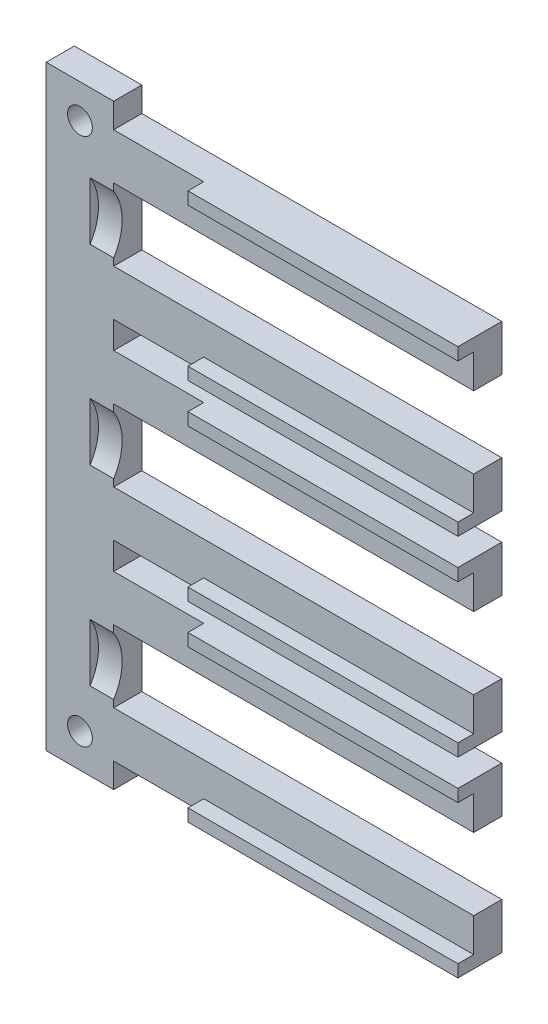
from build123d import *

# Parameters (mm, degrees)
FRONT_GRIP_ACETAL_GUIDE_COMB_SKETCH_W  = 6
FRONT_GRIP_ACETAL_GUIDE_COMB_SKETCH_H  = 53
FRONT_GRIP_ACETAL_GUIDE_COMB_DEPTH     = 2.5
GRIP_GUIDE_LEDGE_1_LOWER_SKETCH_W      = 32.1
GRIP_GUIDE_LEDGE_1_LOWER_SKETCH_H      = 4.1
GRIP_GUIDE_LEDGE_1_LOWER_DEPTH         = 2.5
GRIP_GUIDE_LEDGE_1_UPPER_SKETCH_W      = 32.1
GRIP_GUIDE_LEDGE_1_UPPER_SKETCH_H      = 4.1
GRIP_GUIDE_LEDGE_1_UPPER_DEPTH         = 2.5
GRIP_GUIDE_FENCE_1_LOWER_SKETCH_W      = 24
GRIP_GUIDE_FENCE_1_LOWER_SKETCH_H      = 1.1
GRIP_GUIDE_FENCE_1_LOWER_DEPTH         = 1.5
GRIP_GUIDE_FENCE_1_UPPER_SKETCH_W      = 24
GRIP_GUIDE_FENCE_1_UPPER_SKETCH_H      = 1.1
GRIP_GUIDE_FENCE_1_UPPER_DEPTH         = 1.5
GRIP_GUIDE_LEDGE_2_LOWER_SKETCH_W      = 32.1
GRIP_GUIDE_LEDGE_2_LOWER_SKETCH_H      = 4.1
GRIP_GUIDE_LEDGE_2_LOWER_DEPTH         = 2.5
GRIP_GUIDE_LEDGE_2_UPPER_SKETCH_W      = 32.1
GRIP_GUIDE_LEDGE_2_UPPER_SKETCH_H      = 4.1
GRIP_GUIDE_LEDGE_2_UPPER_DEPTH         = 2.5
GRIP_GUIDE_FENCE_2_LOWER_SKETCH_W      = 24
GRIP_GUIDE_FENCE_2_LOWER_SKETCH_H      = 1.1
GRIP_GUIDE_FENCE_2_LOWER_DEPTH         = 1.5
GRIP_GUIDE_FENCE_2_UPPER_SKETCH_W      = 24
GRIP_GUIDE_FENCE_2_UPPER_SKETCH_H      = 1.1
GRIP_GUIDE_FENCE_2_UPPER_DEPTH         = 1.5
GRIP_GUIDE_LEDGE_3_LOWER_SKETCH_W      = 32.1
GRIP_GUIDE_LEDGE_3_LOWER_SKETCH_H      = 4.1
GRIP_GUIDE_LEDGE_3_LOWER_DEPTH         = 2.5
GRIP_GUIDE_LEDGE_3_UPPER_SKETCH_W      = 32.1
GRIP_GUIDE_LEDGE_3_UPPER_SKETCH_H      = 4.1
GRIP_GUIDE_LEDGE_3_UPPER_DEPTH         = 2.5
GRIP_GUIDE_FENCE_3_LOWER_SKETCH_W      = 24
GRIP_GUIDE_FENCE_3_LOWER_SKETCH_H      = 1.1
GRIP_GUIDE_FENCE_3_LOWER_DEPTH         = 1.5
GRIP_GUIDE_FENCE_3_UPPER_SKETCH_W      = 24
GRIP_GUIDE_FENCE_3_UPPER_SKETCH_H      = 1.1
GRIP_GUIDE_FENCE_3_UPPER_DEPTH         = 1.5
FRONT_GUIDE_SCREW_CLEARANCE_1_SKETCH_R = 1.1
FRONT_GUIDE_SCREW_CLEARANCE_1_DEPTH    = 2.7
FRONT_GUIDE_SCREW_CLEARANCE_2_SKETCH_R = 1.1
FRONT_GUIDE_SCREW_CLEARANCE_2_DEPTH    = 2.7
OUTLET_SEAT_CLEARANCE_1_SKETCH_R       = 4.75
OUTLET_SEAT_CLEARANCE_1_DEPTH          = 2.2
OUTLET_SEAT_CLEARANCE_2_SKETCH_R       = 4.75
OUTLET_SEAT_CLEARANCE_2_DEPTH          = 2.2
OUTLET_SEAT_CLEARANCE_3_SKETCH_R       = 4.75
OUTLET_SEAT_CLEARANCE_3_DEPTH          = 2.2


with BuildPart() as part:
    # Front Grip Acetal Guide Comb sketch → Front Grip Acetal Guide Comb (new body)
    with BuildSketch(Plane.XY.offset(8.5)):
        with Locations((-63.291651246, -29)):
            Rectangle(FRONT_GRIP_ACETAL_GUIDE_COMB_SKETCH_W, FRONT_GRIP_ACETAL_GUIDE_COMB_SKETCH_H)
    extrude(amount=FRONT_GRIP_ACETAL_GUIDE_COMB_DEPTH)

    # Grip Guide Ledge 1 Lower sketch → Grip Guide Ledge 1 Lower (add)
    with BuildSketch(Plane.XY.offset(8.5)):
        with Locations((-44.341651246, -6.75)):
            Rectangle(GRIP_GUIDE_LEDGE_1_LOWER_SKETCH_W, GRIP_GUIDE_LEDGE_1_LOWER_SKETCH_H)
    extrude(amount=GRIP_GUIDE_LEDGE_1_LOWER_DEPTH)

    # Grip Guide Ledge 1 Upper sketch → Grip Guide Ledge 1 Upper (add)
    with BuildSketch(Plane.XY.offset(8.5)):
        with Locations((-44.341651246, -17.25)):
            Rectangle(GRIP_GUIDE_LEDGE_1_UPPER_SKETCH_W, GRIP_GUIDE_LEDGE_1_UPPER_SKETCH_H)
    extrude(amount=GRIP_GUIDE_LEDGE_1_UPPER_DEPTH)

    # Grip Guide Fence 1 Lower sketch → Grip Guide Fence 1 Lower (add)
    with BuildSketch(Plane.XY.offset(10.9)):
        with Locations((-40.291651246, -5.25)):
            Rectangle(GRIP_GUIDE_FENCE_1_LOWER_SKETCH_W, GRIP_GUIDE_FENCE_1_LOWER_SKETCH_H)
    extrude(amount=GRIP_GUIDE_FENCE_1_LOWER_DEPTH)

    # Grip Guide Fence 1 Upper sketch → Grip Guide Fence 1 Upper (add)
    with BuildSketch(Plane.XY.offset(10.9)):
        with Locations((-40.291651246, -18.75)):
            Rectangle(GRIP_GUIDE_FENCE_1_UPPER_SKETCH_W, GRIP_GUIDE_FENCE_1_UPPER_SKETCH_H)
    extrude(amount=GRIP_GUIDE_FENCE_1_UPPER_DEPTH)

    # Grip Guide Ledge 2 Lower sketch → Grip Guide Ledge 2 Lower (add)
    with BuildSketch(Plane.XY.offset(8.5)):
        with Locations((-44.341651246, -23.75)):
            Rectangle(GRIP_GUIDE_LEDGE_2_LOWER_SKETCH_W, GRIP_GUIDE_LEDGE_2_LOWER_SKETCH_H)
    extrude(amount=GRIP_GUIDE_LEDGE_2_LOWER_DEPTH)

    # Grip Guide Ledge 2 Upper sketch → Grip Guide Ledge 2 Upper (add)
    with BuildSketch(Plane.XY.offset(8.5)):
        with Locations((-44.341651246, -34.25)):
            Rectangle(GRIP_GUIDE_LEDGE_2_UPPER_SKETCH_W, GRIP_GUIDE_LEDGE_2_UPPER_SKETCH_H)
    extrude(amount=GRIP_GUIDE_LEDGE_2_UPPER_DEPTH)

    # Grip Guide Fence 2 Lower sketch → Grip Guide Fence 2 Lower (add)
    with BuildSketch(Plane.XY.offset(10.9)):
        with Locations((-40.291651246, -22.25)):
            Rectangle(GRIP_GUIDE_FENCE_2_LOWER_SKETCH_W, GRIP_GUIDE_FENCE_2_LOWER_SKETCH_H)
    extrude(amount=GRIP_GUIDE_FENCE_2_LOWER_DEPTH)

    # Grip Guide Fence 2 Upper sketch → Grip Guide Fence 2 Upper (add)
    with BuildSketch(Plane.XY.offset(10.9)):
        with Locations((-40.291651246, -35.75)):
            Rectangle(GRIP_GUIDE_FENCE_2_UPPER_SKETCH_W, GRIP_GUIDE_FENCE_2_UPPER_SKETCH_H)
    extrude(amount=GRIP_GUIDE_FENCE_2_UPPER_DEPTH)

    # Grip Guide Ledge 3 Lower sketch → Grip Guide Ledge 3 Lower (add)
    with BuildSketch(Plane.XY.offset(8.5)):
        with Locations((-44.341651246, -40.75)):
            Rectangle(GRIP_GUIDE_LEDGE_3_LOWER_SKETCH_W, GRIP_GUIDE_LEDGE_3_LOWER_SKETCH_H)
    extrude(amount=GRIP_GUIDE_LEDGE_3_LOWER_DEPTH)

    # Grip Guide Ledge 3 Upper sketch → Grip Guide Ledge 3 Upper (add)
    with BuildSketch(Plane.XY.offset(8.5)):
        with Locations((-44.341651246, -51.25)):
            Rectangle(GRIP_GUIDE_LEDGE_3_UPPER_SKETCH_W, GRIP_GUIDE_LEDGE_3_UPPER_SKETCH_H)
    extrude(amount=GRIP_GUIDE_LEDGE_3_UPPER_DEPTH)

    # Grip Guide Fence 3 Lower sketch → Grip Guide Fence 3 Lower (add)
    with BuildSketch(Plane.XY.offset(10.9)):
        with Locations((-40.291651246, -39.25)):
            Rectangle(GRIP_GUIDE_FENCE_3_LOWER_SKETCH_W, GRIP_GUIDE_FENCE_3_LOWER_SKETCH_H)
    extrude(amount=GRIP_GUIDE_FENCE_3_LOWER_DEPTH)

    # Grip Guide Fence 3 Upper sketch → Grip Guide Fence 3 Upper (add)
    with BuildSketch(Plane.XY.offset(10.9)):
        with Locations((-40.291651246, -52.75)):
            Rectangle(GRIP_GUIDE_FENCE_3_UPPER_SKETCH_W, GRIP_GUIDE_FENCE_3_UPPER_SKETCH_H)
    extrude(amount=GRIP_GUIDE_FENCE_3_UPPER_DEPTH)

    # Front Guide Screw Clearance 1 sketch → Front Guide Screw Clearance 1 (cut)
    with BuildSketch(Plane.XY.offset(8.4)):
        with Locations(Location((-63.291651246, -5.5, 0), (0, 0, 180))):
            Circle(FRONT_GUIDE_SCREW_CLEARANCE_1_SKETCH_R)
    extrude(amount=FRONT_GUIDE_SCREW_CLEARANCE_1_DEPTH, mode=Mode.SUBTRACT)

    # Front Guide Screw Clearance 2 sketch → Front Guide Screw Clearance 2 (cut)
    with BuildSketch(Plane.XY.offset(8.4)):
        with Locations(Location((-63.291651246, -52.5, 0), (0, 0, 180))):
            Circle(FRONT_GUIDE_SCREW_CLEARANCE_2_SKETCH_R)
    extrude(amount=FRONT_GUIDE_SCREW_CLEARANCE_2_DEPTH, mode=Mode.SUBTRACT)

    # Outlet seat clearance 1 sketch → Outlet seat clearance 1 (cut)
    with BuildSketch(Plane(origin=(-62.391651246, 0, 0), x_dir=(0, 0, -1), z_dir=(1, 0, 0))):
        with Locations((-15, -12)):
            Circle(OUTLET_SEAT_CLEARANCE_1_SKETCH_R)
    extrude(amount=OUTLET_SEAT_CLEARANCE_1_DEPTH, mode=Mode.SUBTRACT)

    # Outlet seat clearance 2 sketch → Outlet seat clearance 2 (cut)
    with BuildSketch(Plane(origin=(-62.391651246, 0, 0), x_dir=(0, 0, -1), z_dir=(1, 0, 0))):
        with Locations((-15, -29)):
            Circle(OUTLET_SEAT_CLEARANCE_2_SKETCH_R)
    extrude(amount=OUTLET_SEAT_CLEARANCE_2_DEPTH, mode=Mode.SUBTRACT)

    # Outlet seat clearance 3 sketch → Outlet seat clearance 3 (cut)
    with BuildSketch(Plane(origin=(-62.391651246, 0, 0), x_dir=(0, 0, -1), z_dir=(1, 0, 0))):
        with Locations((-15, -46)):
            Circle(OUTLET_SEAT_CLEARANCE_3_SKETCH_R)
    extrude(amount=OUTLET_SEAT_CLEARANCE_3_DEPTH, mode=Mode.SUBTRACT)


solid = part.part
